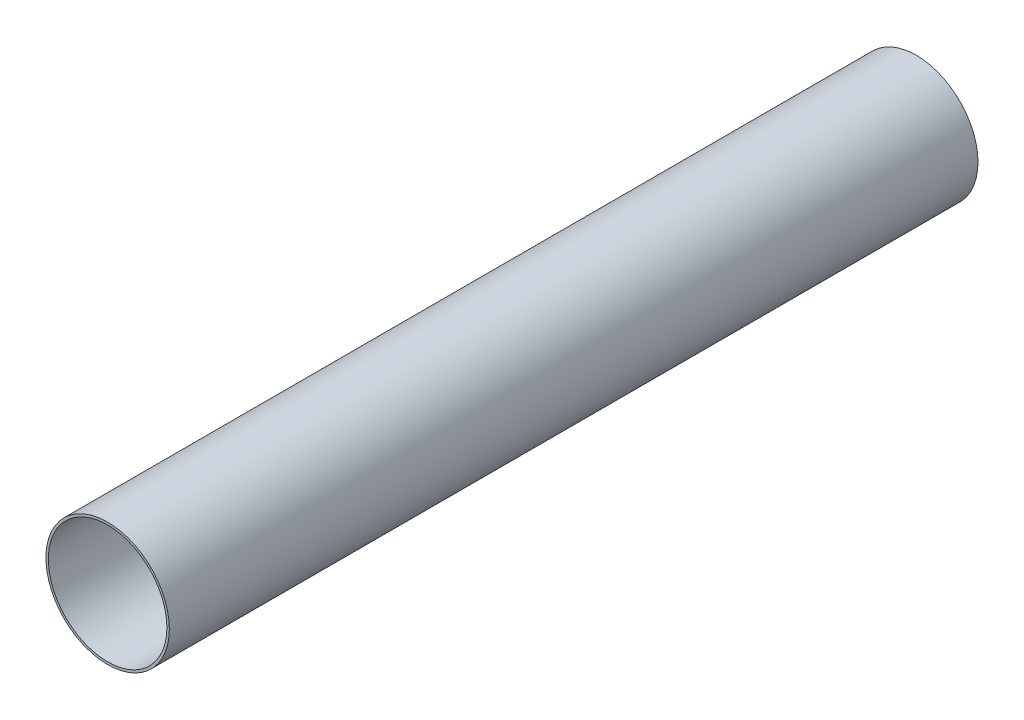
from build123d import *

# Parameters (mm, degrees)
SKETCH1_R           = 11.45
SKETCH1_R_2         = 11
BOSS_EXTRUDE1_DEPTH = 150


with BuildPart() as part:
    # Sketch1 → Boss-Extrude1 (new body)
    with BuildSketch(Plane.XY):
        Circle(SKETCH1_R)
        Circle(SKETCH1_R_2, mode=Mode.SUBTRACT)
    extrude(amount=BOSS_EXTRUDE1_DEPTH)


solid = part.part
